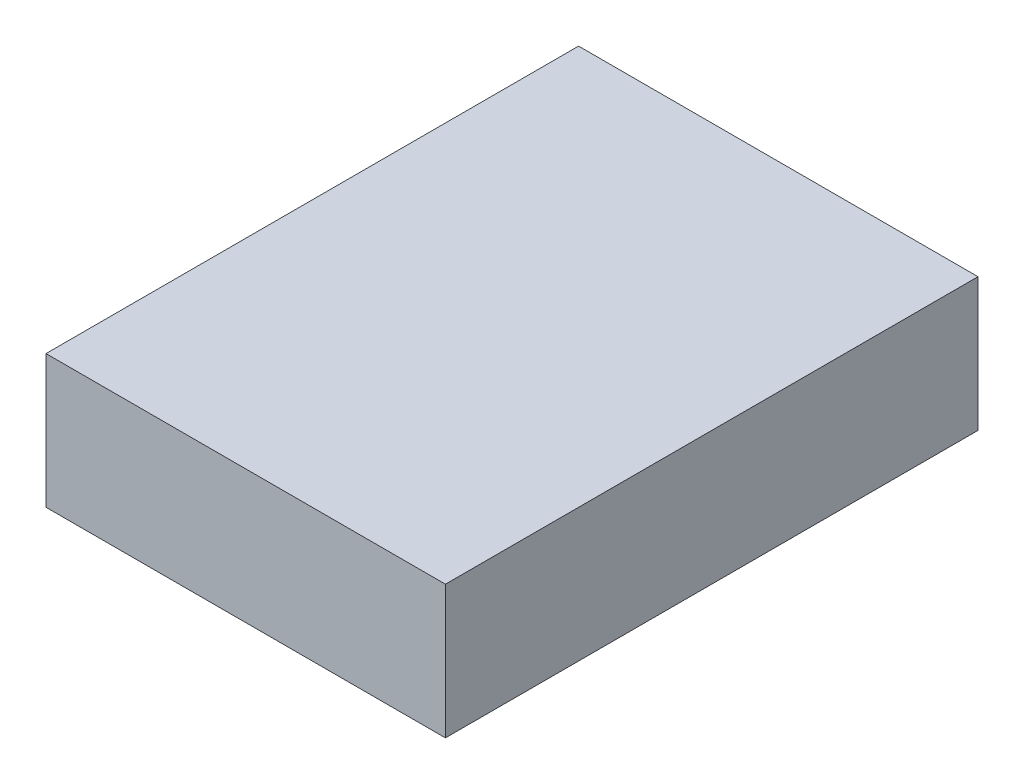
from build123d import *

# Parameters (mm, degrees)
ESBO_O1_W                = 9
ESBO_O1_H                = 12
RESSALTO_EXTRUS_O1_DEPTH = 3


with BuildPart() as part:
    # Esboço1 → Ressalto-extrusão1 (new body)
    with BuildSketch(Plane(origin=(0, 0, 0), x_dir=(1, 0, 0), z_dir=(0, 1, 0))):
        with Locations((-101.731482125, 83.2737739)):
            Rectangle(ESBO_O1_W, ESBO_O1_H)
    extrude(amount=RESSALTO_EXTRUS_O1_DEPTH)


solid = part.part
